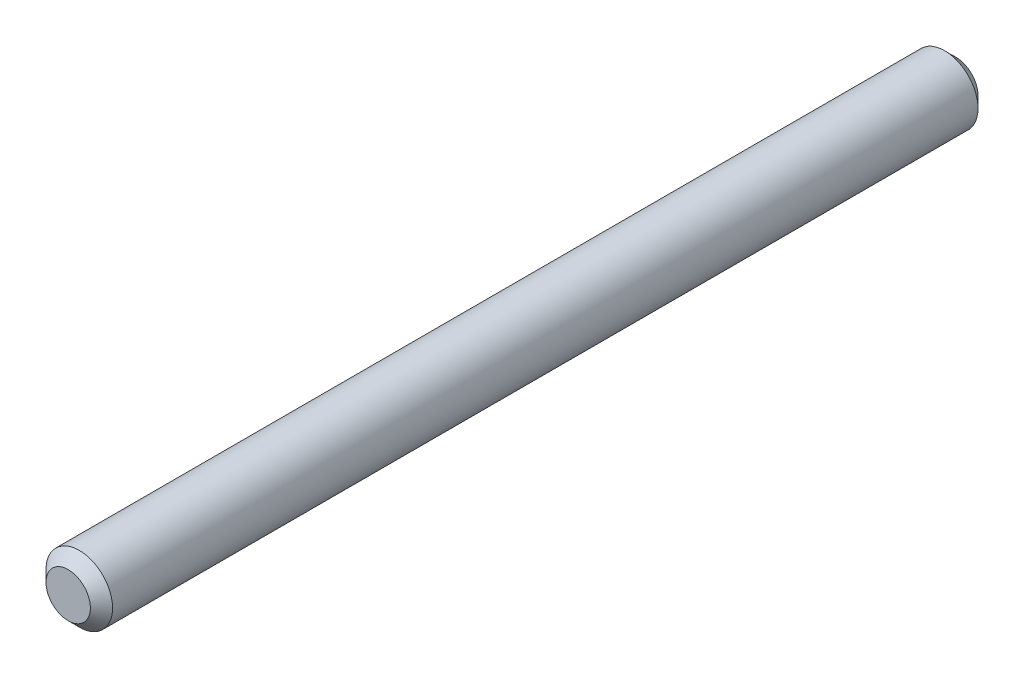
from build123d import *

# Parameters (mm, degrees)
CROQUIS1_R              = 3
SALIENTE_EXTRUIR1_DEPTH = 80
CHAFL_N1_SIZE           = 1


with BuildPart() as part:
    # Croquis1 → Saliente-Extruir1 (new body)
    with BuildSketch(Plane.XY):
        Circle(CROQUIS1_R)
    extrude(amount=SALIENTE_EXTRUIR1_DEPTH)

    # Chaflán1
    chafl_n1_edges = [part.edges().sort_by_distance(p)[0] for p in [
        (-3, 0, 0),
        (-3, 0, 80),
    ]]
    chamfer(chafl_n1_edges, length=CHAFL_N1_SIZE)


solid = part.part
